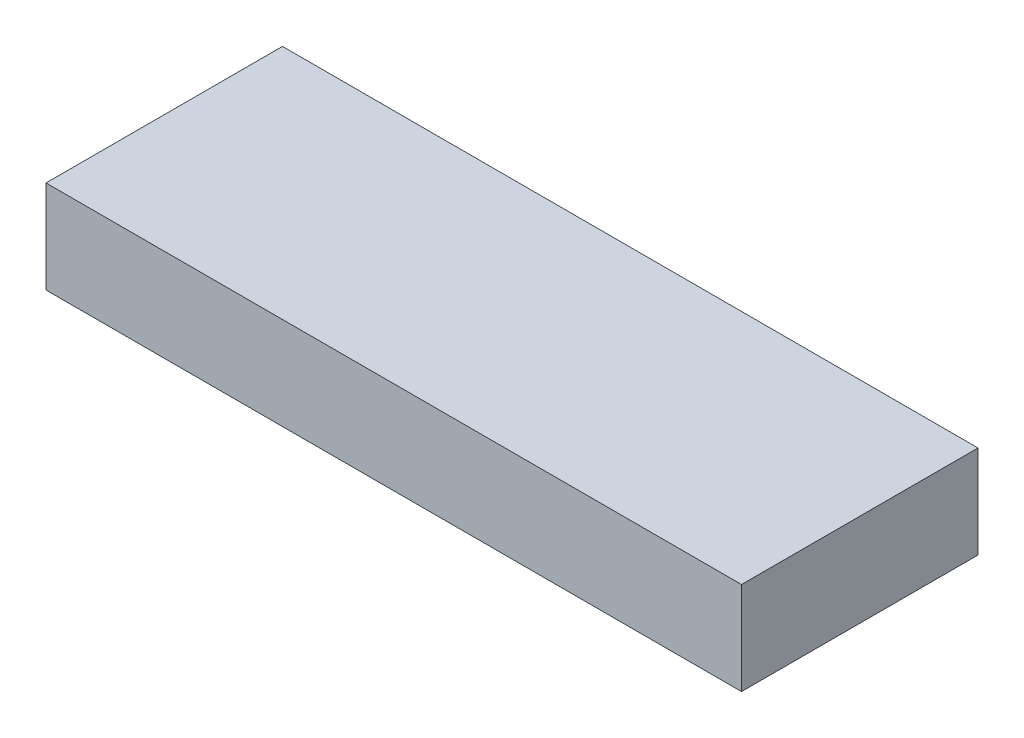
from build123d import *

# Parameters (mm, degrees)
SKETCH1_W           = 150
SKETCH1_H           = 51
BOSS_EXTRUDE1_DEPTH = 20


with BuildPart() as part:
    # Sketch1 → Boss-Extrude1 (new body)
    with BuildSketch(Plane(origin=(0, 0, 0), x_dir=(1, 0, 0), z_dir=(0, 1, 0))):
        Rectangle(SKETCH1_W, SKETCH1_H)
    extrude(amount=BOSS_EXTRUDE1_DEPTH)


solid = part.part
